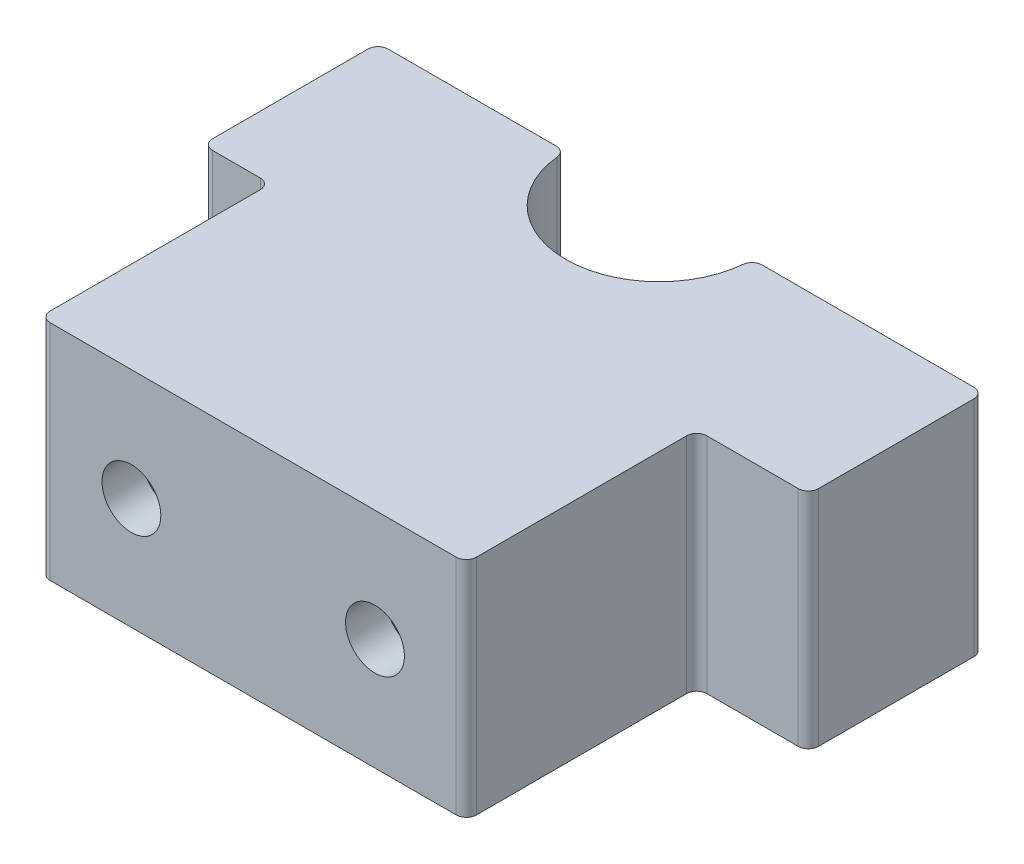
from build123d import *

# Parameters (mm, degrees)
BOSS_EXTRUDE1_DEPTH = 11
SKETCH2_R           = 1.45
CUT_EXTRUDE1_DEPTH  = 8
SKETCH3_R           = 1.2
CUT_EXTRUDE2_DEPTH  = 10
CUT_EXTRUDE3_START  = -2
SKETCH5_R           = 1.2
CUT_EXTRUDE3_DEPTH  = 2.4
CUT_EXTRUDE4_START  = -2
CUT_EXTRUDE4_DEPTH  = 2.4
SKETCH1_4_W         = 5.5
SKETCH1_4_H         = 8.65
SKETCH1_4_W_2       = 3.35
BOSS_EXTRUDE2_DEPTH = 11
FILLET2_R           = 0.5


with BuildPart() as part:
    # Sketch1 → Boss-Extrude1 (new body)
    with BuildSketch(Plane(origin=(0, 0, 0), x_dir=(1, 0, 0), z_dir=(0, 1, 0))):
        with BuildLine():
            ThreePointArc((-4.6, 10), (0, 5.4), (4.6, 10))
            Line((4.6, 10), (10.5, 10))
            Line((10.5, 10), (10.5, -10))
            Line((10.5, -10), (-10.5, -10))
            Line((-10.5, -10), (-10.5, 10))
            Line((-10.5, 10), (-4.6, 10))
        make_face()
    extrude(amount=BOSS_EXTRUDE1_DEPTH)

    # Sketch2 → Cut-Extrude1 (cut)
    with BuildSketch(Plane.XY.offset(10)):
        with Locations((-6, 5.5)):
            Circle(SKETCH2_R)
        with Locations((6, 5.5)):
            Circle(SKETCH2_R)
    extrude(amount=-CUT_EXTRUDE1_DEPTH, mode=Mode.SUBTRACT)

    # Sketch3 → Cut-Extrude2 (cut)
    with BuildSketch(Plane(origin=(0, 0, -10), x_dir=(-1, 0, 0), z_dir=(0, 0, -1))):
        with Locations((-8.1, 5.5)):
            Circle(SKETCH3_R)
        with Locations((8.1, 5.5)):
            Circle(SKETCH3_R)
    extrude(amount=-CUT_EXTRUDE2_DEPTH, mode=Mode.SUBTRACT)

    # Sketch5 → Cut-Extrude3 (cut)
    # profile 1 of 2: a face of its own
    with BuildSketch(Plane(origin=(0, 0, -10), x_dir=(-1, 0, 0), z_dir=(0, 0, -1)).offset(CUT_EXTRUDE3_START)):
        Polygon((-6, 0), (-6, 4.287564435), (-6, 6.712435565), (-8.1, 7.924871131), (-10.2, 6.712435565), (-10.2, 4.287564435), (-10.2, 0), align=None)
        with Locations((-8.1, 5.5)):
            Circle(SKETCH5_R, mode=Mode.SUBTRACT)
    # profile 2 of 2: a face of its own
    with BuildSketch(Plane(origin=(0, 0, -10), x_dir=(-1, 0, 0), z_dir=(0, 0, -1)).offset(CUT_EXTRUDE3_START)):
        Polygon((6, 0), (10.2, 0), (10.2, 4.287564435), (10.2, 6.712435565), (8.1, 7.924871131), (6, 6.712435565), (6, 4.287564435), align=None)
    extrude(amount=-CUT_EXTRUDE3_DEPTH, mode=Mode.SUBTRACT)

    # Sketch6 → Cut-Extrude4 (cut)
    with BuildSketch(Plane.XY.offset(10).offset(CUT_EXTRUDE4_START)):
        Polygon((-6, 8.559956427), (-8.65, 7.029978213), (-8.65, 3.970021787), (-8.65, 0), (-3.35, 0), (-3.35, 3.970021787), (-3.35, 7.029978213), align=None)
        Polygon((6, 8.559956427), (3.35, 7.029978213), (3.35, 3.970021787), (3.35, 0), (8.65, 0), (8.65, 3.970021787), (8.65, 7.029978213), align=None)
    extrude(amount=-CUT_EXTRUDE4_DEPTH, mode=Mode.SUBTRACT)

    # Sketch1<4> → Boss-Extrude2 (add, through all)
    with BuildSketch(Plane(origin=(0, 0, 0), x_dir=(1, 0, 0), z_dir=(0, 1, 0))):
        with Locations((13.25, 5.675)):
            Rectangle(SKETCH1_4_W, SKETCH1_4_H)
        with Locations((-12.175, 5.675)):
            Rectangle(SKETCH1_4_W_2, SKETCH1_4_H)
    extrude(amount=BOSS_EXTRUDE2_DEPTH)

    # Fillet2
    fillet2_edges = [part.edges().sort_by_distance(p)[0] for p in [
        (10.5, 5.5, -1.35),
        (16, 5.5, -1.35),
        (16, 5.5, -10),
        (4.6, 5.5, -10),
        (10.5, 5.5, 10),
        (-10.5, 5.5, 10),
        (-4.6, 5.5, -10),
        (-13.85, 5.5, -10),
        (-13.85, 5.5, -1.35),
        (-10.5, 5.5, -1.35),
    ]]
    fillet(fillet2_edges, radius=FILLET2_R)


solid = part.part
